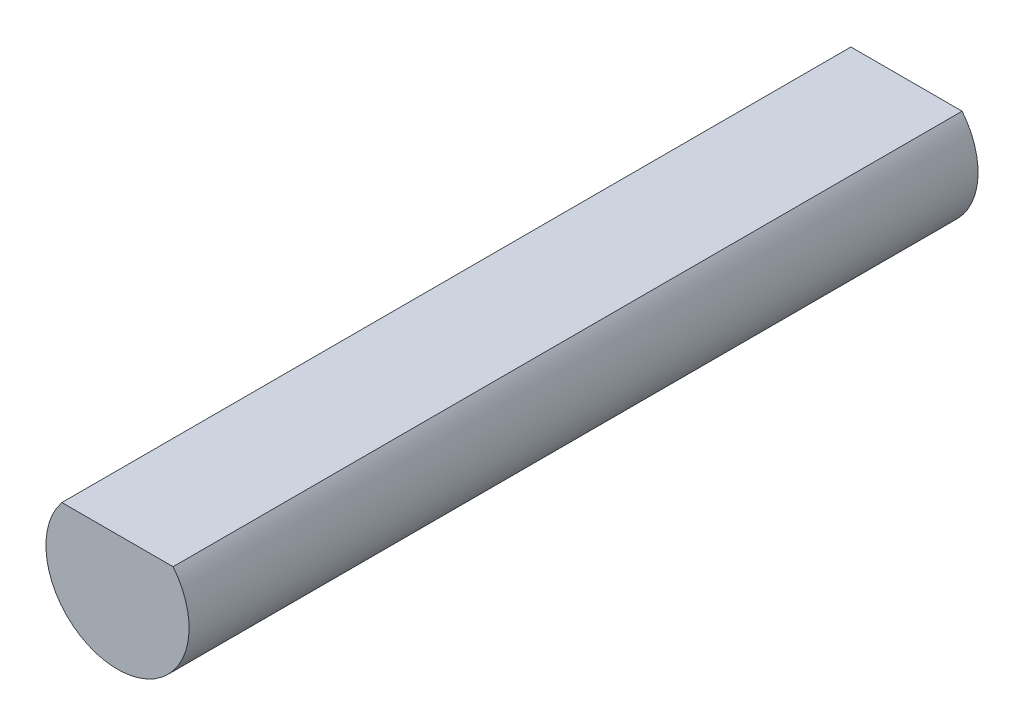
from build123d import *

# Parameters (mm, degrees)
BOSS_EXTRUDE1_DEPTH = 35


with BuildPart() as part:
    # Sketch2 → Boss-Extrude1 (new body)
    with BuildSketch(Plane.XY):
        with BuildLine():
            Line((-2.465892333, 2), (2.465892333, 2))
            ThreePointArc((2.465892333, 2), (0, -3.175), (-2.465892333, 2))
        make_face()
    extrude(amount=BOSS_EXTRUDE1_DEPTH)


solid = part.part
